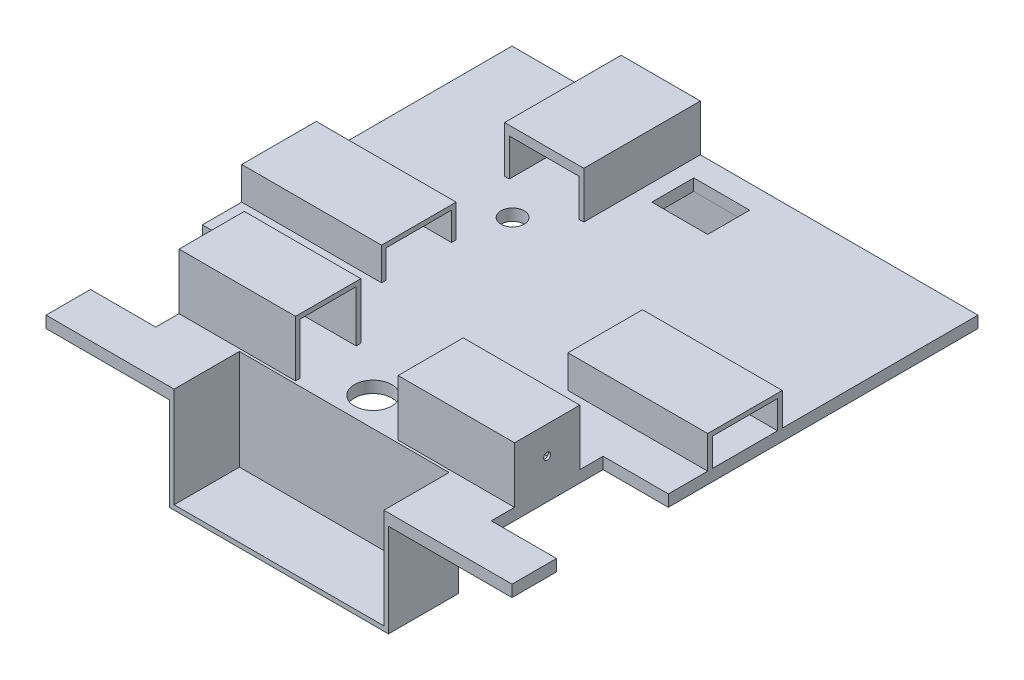
from build123d import *

# Parameters (mm, degrees)
SKETCH1_W                = 12
SKETCH1_H                = 9
BOSS_EXTRUDE1_DEPTH      = 2.5
SKETCH2_W                = 17
SKETCH2_H                = 25
BOSS_EXTRUDE2_DEPTH      = 10
SKETCH4_W                = 15
SKETCH4_H                = 8
CUT_EXTRUDE1_DEPTH       = 42
SKETCH7_W                = 14
SKETCH7_H                = 12
BOSS_EXTRUDE3_DEPTH      = 72
SKETCH8_R                = 0.75
CUT_EXTRUDE2_DEPTH       = 72
SKETCH9_W                = 22
SKETCH9_H                = 12
CUT_EXTRUDE3_DEPTH       = 37
SKETCH5_R                = 2.5
CUT_EXTRUDE6_DEPTH       = 23.5
SKETCH12_W               = 47
SKETCH12_H               = 15
BOSS_EXTRUDE4_DEPTH      = 20
SKETCH13_W               = 45
SKETCH13_H               = 21.5
CUT_EXTRUDE7_DEPTH       = 14
SKETCH14_W               = 47
SKETCH14_H               = 4.916428424
BOSS_EXTRUDE5_DEPTH      = 20
SKETCH15_W               = 45
SKETCH15_H               = 3.916428424
CUT_EXTRUDE8_DEPTH       = 20
SKETCH16_W               = 30
SKETCH16_H               = 16
BOSS_EXTRUDE6_DEPTH      = 7
SKETCH17_W               = 14
SKETCH17_H               = 6
CUT_EXTRUDE9_DEPTH       = 100
CUT_EXTRUDE10_DEPTH      = 46.5
CUT_EXTRUDE10_DEPTH_BACK = 24.5
SKETCH19_W               = 12
SKETCH19_H               = 11
SKETCH21_R               = 4
CUT_EXTRUDE11_DEPTH      = 24.5


with BuildPart() as part:
    # Sketch1 → Boss-Extrude1 (new body)
    with BuildSketch(Plane(origin=(0, 0, 0), x_dir=(1, 0, 0), z_dir=(0, 1, 0))):
        Polygon((-50, -40.45305067), (-50, -50), (50, -50), (50, -40.45305067), (36, -40.45305067), (36, -16.45305067), (50, -16.45305067), (50, 50), (-50, 50), (-50, -16.45305067), (-36, -16.45305067), (-36, -40.45305067), align=None)
        with Locations((0, 40.5)):
            Rectangle(SKETCH1_W, SKETCH1_H, mode=Mode.SUBTRACT)
    extrude(amount=BOSS_EXTRUDE1_DEPTH)

    # Sketch2 → Boss-Extrude2 (add)
    with BuildSketch(Plane(origin=(0, 2.5, 0), x_dir=(1, 0, 0), z_dir=(0, 1, 0))):
        with Locations((-18.083526834, 37.5)):
            Rectangle(SKETCH2_W, SKETCH2_H)
    extrude(amount=BOSS_EXTRUDE2_DEPTH)

    # Sketch4 → Cut-Extrude1 (cut)
    with BuildSketch(Plane.XY.offset(-25)):
        with Locations((-18.083526834, 6.5)):
            Rectangle(SKETCH4_W, SKETCH4_H)
    extrude(amount=-CUT_EXTRUDE1_DEPTH, mode=Mode.SUBTRACT)

    # Sketch7 → Boss-Extrude3 (add)
    with BuildSketch(Plane.ZY.offset(36)):
        with Locations((28.45305067, 8.5)):
            Rectangle(SKETCH7_W, SKETCH7_H)
    extrude(amount=-BOSS_EXTRUDE3_DEPTH)

    # Sketch8 → Cut-Extrude2 (cut)
    with BuildSketch(Plane.ZY.offset(36)):
        with Locations((28.45305067, 8.5)):
            Circle(SKETCH8_R)
    extrude(amount=-CUT_EXTRUDE2_DEPTH, mode=Mode.SUBTRACT)

    # Sketch9 → Cut-Extrude3 (cut)
    with BuildSketch(Plane.XY.offset(35.45305067)):
        with Locations((0, 8.5)):
            Rectangle(SKETCH9_W, SKETCH9_H)
    extrude(amount=-CUT_EXTRUDE3_DEPTH, mode=Mode.SUBTRACT)

    # Sketch5 → Cut-Extrude6 (cut)
    with BuildSketch(Plane(origin=(0, 2.5, 0), x_dir=(1, 0, 0), z_dir=(0, 1, 0))):
        with Locations(Location((-18.083526834, 18.209316503, 0), (0, 0, 270))):
            Circle(SKETCH5_R)
    extrude(amount=-CUT_EXTRUDE6_DEPTH, mode=Mode.SUBTRACT)

    # Sketch12 → Boss-Extrude4 (add)
    with BuildSketch(Plane.XZ):
        with Locations((0, 42.5)):
            Rectangle(SKETCH12_W, SKETCH12_H)
    extrude(amount=BOSS_EXTRUDE4_DEPTH)

    # Sketch13 → Cut-Extrude7 (cut)
    with BuildSketch(Plane.XY.offset(50)):
        with Locations((0, -8.25)):
            Rectangle(SKETCH13_W, SKETCH13_H)
    extrude(amount=-CUT_EXTRUDE7_DEPTH, mode=Mode.SUBTRACT)

    # Sketch14 → Boss-Extrude5 (add)
    with BuildSketch(Plane.XZ):
        with Locations((0, -47.541785788)):
            Rectangle(SKETCH14_W, SKETCH14_H)
    extrude(amount=BOSS_EXTRUDE5_DEPTH)

    # Sketch15 → Cut-Extrude8 (cut)
    with BuildSketch(Plane.XZ.offset(20)):
        with Locations((0, -48.041785788)):
            Rectangle(SKETCH15_W, SKETCH15_H)
    extrude(amount=-CUT_EXTRUDE8_DEPTH, mode=Mode.SUBTRACT)

    # Sketch16 → Boss-Extrude6 (add)
    with BuildSketch(Plane(origin=(0, 2.5, 0), x_dir=(1, 0, 0), z_dir=(0, 1, 0))):
        with Locations((-35, 0)):
            Rectangle(SKETCH16_W, SKETCH16_H)
        with Locations((35, 0)):
            Rectangle(SKETCH16_W, SKETCH16_H)
    extrude(amount=BOSS_EXTRUDE6_DEPTH)

    # Sketch17 → Cut-Extrude9 (cut)
    with BuildSketch(Plane.ZY.offset(50)):
        with Locations((0, 5.5)):
            Rectangle(SKETCH17_W, SKETCH17_H)
    extrude(amount=-CUT_EXTRUDE9_DEPTH, mode=Mode.SUBTRACT)

    # Sketch19 → Cut-Extrude10 (cut, two sides: drawn at the far end of the back side and taken through both)
    with BuildSketch(Plane(origin=(-11, 0, 0), x_dir=(0, 0, -1), z_dir=(1, 0, 0)).offset(-CUT_EXTRUDE10_DEPTH_BACK)):
        with Locations((-28.45305067, 8)):
            Rectangle(SKETCH19_W, SKETCH19_H)
    extrude(amount=CUT_EXTRUDE10_DEPTH + CUT_EXTRUDE10_DEPTH_BACK, mode=Mode.SUBTRACT)

    # Sketch21 → Cut-Extrude11 (cut)
    with BuildSketch(Plane(origin=(0, 2.5, 0), x_dir=(1, 0, 0), z_dir=(0, 1, 0))):
        with Locations(Location((0, -29.805394333, 0), (0, 0, 270))):
            Circle(SKETCH21_R)
    extrude(amount=-CUT_EXTRUDE11_DEPTH, mode=Mode.SUBTRACT)


solid = part.part
